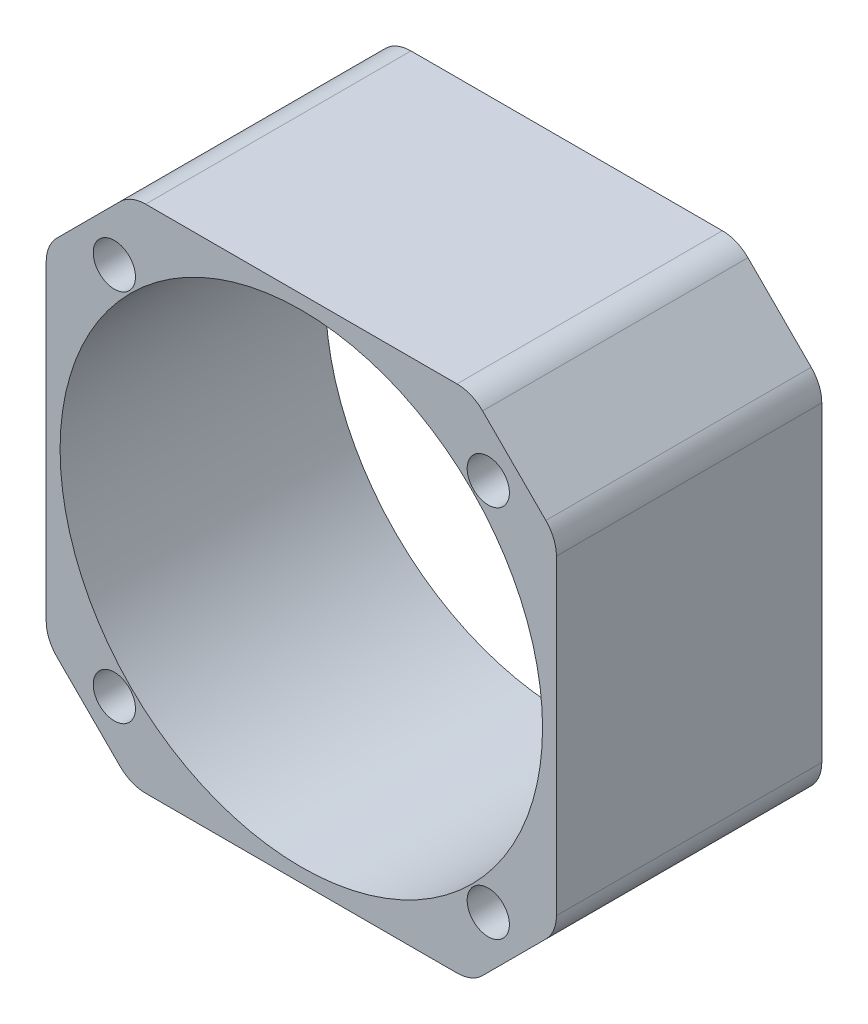
from build123d import *

# Parameters (mm, degrees)
SZKIC1_W                    = 42.3
SZKIC1_H                    = 42.3
DODANIE_WYCI_GNI_CIE1_DEPTH = 22
SFAZOWANIE1_SIZE            = 7
ZAOKR_GLENIE1_R             = 3
WYTNIJ_WYCI_GNI_CIE1_REACH  = 39.13
SZKIC2_R                    = 20
SZKIC2_R_2                  = 1.75


with BuildPart() as part:
    # Szkic1 → Dodanie-wyciągnięcie1 (new body)
    with BuildSketch(Plane.XY):
        Rectangle(SZKIC1_W, SZKIC1_H)
    extrude(amount=DODANIE_WYCI_GNI_CIE1_DEPTH)

    # Sfazowanie1
    sfazowanie1_edges = [part.edges().sort_by_distance(p)[0] for p in [
        (21.15, -21.15, 11),
        (-21.15, -21.15, 11),
        (-21.15, 21.15, 11),
        (21.15, 21.15, 11),
    ]]
    chamfer(sfazowanie1_edges, length=SFAZOWANIE1_SIZE)

    # Zaokrąglenie1
    zaokr_glenie1_edges = [part.edges().sort_by_distance(p)[0] for p in [
        (14.15, -21.15, 11),
        (-14.15, -21.15, 11),
        (-21.15, 14.15, 11),
        (-21.15, -14.15, 11),
        (21.15, 14.15, 11),
        (21.15, -14.15, 11),
        (14.15, 21.15, 11),
        (-14.15, 21.15, 11),
    ]]
    fillet(zaokr_glenie1_edges, radius=ZAOKR_GLENIE1_R)

    # Szkic2 → Wytnij-wyciągnięcie1 (cut, up to next)
    with BuildSketch(Plane.XY.offset(22), mode=Mode.PRIVATE) as wytnij_wyci_gni_cie1_sk1:
        Circle(SZKIC2_R)
    wytnij_wyci_gni_cie1_tool1 = extrude(wytnij_wyci_gni_cie1_sk1.sketch, amount=-WYTNIJ_WYCI_GNI_CIE1_REACH, mode=Mode.PRIVATE) & part.part
    # Szkic2 → Wytnij-wyciągnięcie1 (cut, up to next)
    with BuildSketch(Plane.XY.offset(22), mode=Mode.PRIVATE) as wytnij_wyci_gni_cie1_sk2:
        with Locations((-15.5, 15.5)):
            Circle(SZKIC2_R_2)
    wytnij_wyci_gni_cie1_tool2 = extrude(wytnij_wyci_gni_cie1_sk2.sketch, amount=-WYTNIJ_WYCI_GNI_CIE1_REACH, mode=Mode.PRIVATE) & part.part
    # Szkic2 → Wytnij-wyciągnięcie1 (cut, up to next)
    with BuildSketch(Plane.XY.offset(22), mode=Mode.PRIVATE) as wytnij_wyci_gni_cie1_sk3:
        with Locations((15.5, 15.5)):
            Circle(SZKIC2_R_2)
    wytnij_wyci_gni_cie1_tool3 = extrude(wytnij_wyci_gni_cie1_sk3.sketch, amount=-WYTNIJ_WYCI_GNI_CIE1_REACH, mode=Mode.PRIVATE) & part.part
    # Szkic2 → Wytnij-wyciągnięcie1 (cut, up to next)
    with BuildSketch(Plane.XY.offset(22), mode=Mode.PRIVATE) as wytnij_wyci_gni_cie1_sk4:
        with Locations((15.5, -15.5)):
            Circle(SZKIC2_R_2)
    wytnij_wyci_gni_cie1_tool4 = extrude(wytnij_wyci_gni_cie1_sk4.sketch, amount=-WYTNIJ_WYCI_GNI_CIE1_REACH, mode=Mode.PRIVATE) & part.part
    # Szkic2 → Wytnij-wyciągnięcie1 (cut, up to next)
    with BuildSketch(Plane.XY.offset(22), mode=Mode.PRIVATE) as wytnij_wyci_gni_cie1_sk5:
        with Locations((-15.5, -15.5)):
            Circle(SZKIC2_R_2)
    wytnij_wyci_gni_cie1_tool5 = extrude(wytnij_wyci_gni_cie1_sk5.sketch, amount=-WYTNIJ_WYCI_GNI_CIE1_REACH, mode=Mode.PRIVATE) & part.part
    add(wytnij_wyci_gni_cie1_tool1.solids().sort_by_distance((0, 0, 22))[0], mode=Mode.SUBTRACT)
    add(wytnij_wyci_gni_cie1_tool2.solids().sort_by_distance((-15.5, 15.5, 22))[0], mode=Mode.SUBTRACT)
    add(wytnij_wyci_gni_cie1_tool3.solids().sort_by_distance((15.5, 15.5, 22))[0], mode=Mode.SUBTRACT)
    add(wytnij_wyci_gni_cie1_tool4.solids().sort_by_distance((15.5, -15.5, 22))[0], mode=Mode.SUBTRACT)
    add(wytnij_wyci_gni_cie1_tool5.solids().sort_by_distance((-15.5, -15.5, 22))[0], mode=Mode.SUBTRACT)


solid = part.part
